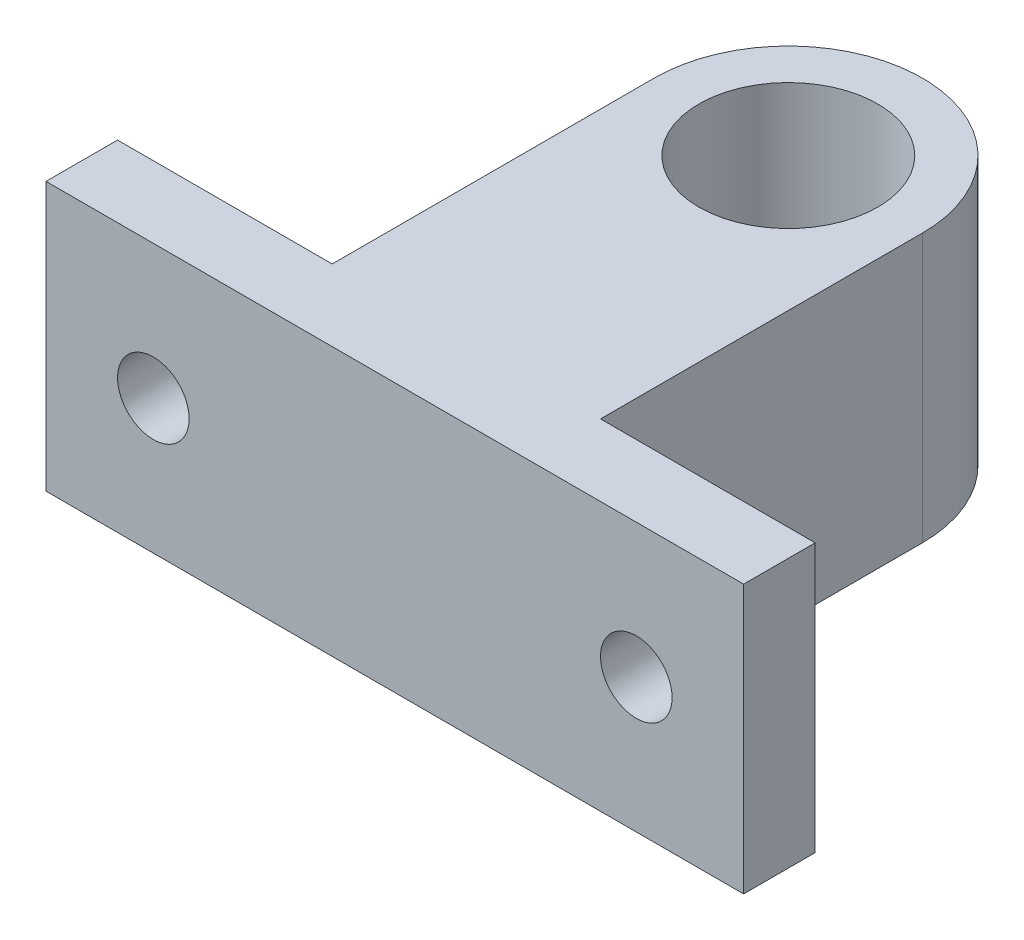
from build123d import *

# Parameters (mm, degrees)
BOSS_EXTRU_1_DEPTH      = 15
BOSS_EXTRU_2_DEPTH      = 12
BOSS_EXTRU_2_DEPTH_BACK = 27
ESQUISSE2_W             = 4
ESQUISSE2_H             = 15
ESQUISSE3_R             = 2
ENL_V_MAT_EXTRU_1_DEPTH = 12


with BuildPart() as part:
    # Esquisse1 → Boss.-Extru.1 (new body)
    with BuildSketch(Plane(origin=(0, 0, 0), x_dir=(1, 0, 0), z_dir=(0, 1, 0))):
        with BuildLine():
            ThreePointArc((17.5, 22), (10, 29.5), (2.5, 22))
            Line((2.5, 22), (5, 22))
            ThreePointArc((5, 22), (10, 27), (15, 22))
            Line((15, 22), (17.5, 22))
        make_face()
        with BuildLine():
            Line((5, 22), (2.5, 22))
            ThreePointArc((2.5, 22), (10, 14.5), (17.5, 22))
            Line((17.5, 22), (15, 22))
            ThreePointArc((15, 22), (10, 17), (5, 22))
        make_face()
        with BuildLine():
            Line((2.5, 22), (2.5, 0))
            Line((2.5, 0), (17.5, 0))
            Line((17.5, 0), (17.5, 22))
            ThreePointArc((17.5, 22), (10, 14.5), (2.5, 22))
        make_face()
    extrude(amount=BOSS_EXTRU_1_DEPTH)

    # Esquisse2 → Boss.-Extru.2 (add, two sides: drawn at the far end of the back side and taken through both)
    with BuildSketch(Plane(origin=(17.5, 0, 0), x_dir=(0, 0, -1), z_dir=(1, 0, 0)).offset(-BOSS_EXTRU_2_DEPTH_BACK)):
        with Locations((2, 7.5)):
            Rectangle(ESQUISSE2_W, ESQUISSE2_H)
    extrude(amount=BOSS_EXTRU_2_DEPTH + BOSS_EXTRU_2_DEPTH_BACK)

    # Esquisse3 → Enlèv. mat.-Extru.1 (cut)
    with BuildSketch(Plane.XY):
        with Locations((-3.5, 7.5)):
            Circle(ESQUISSE3_R)
        with Locations((23.5, 7.5)):
            Circle(ESQUISSE3_R)
    extrude(amount=-ENL_V_MAT_EXTRU_1_DEPTH, mode=Mode.SUBTRACT)


solid = part.part
